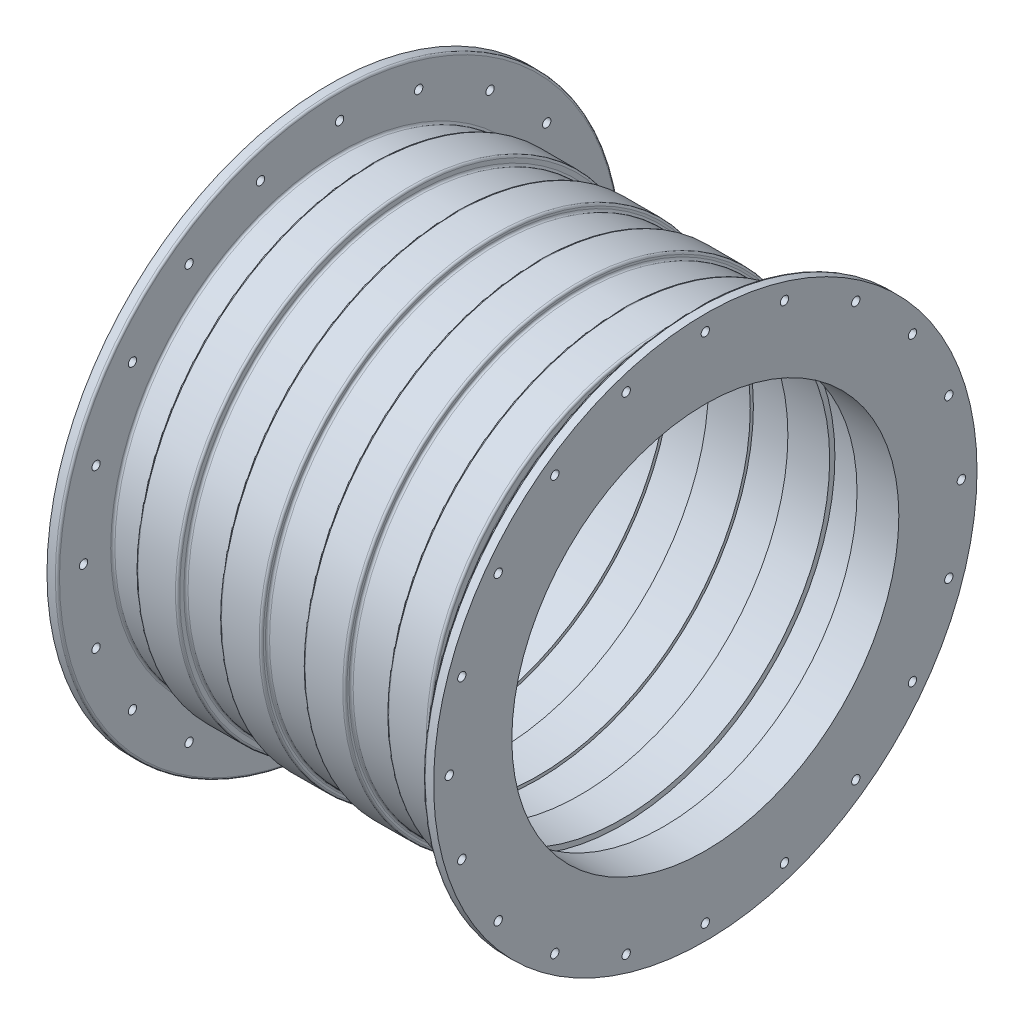
from build123d import *

# Parameters (mm, degrees)
SKETCH2_R          = 2
CUT_EXTRUDE1_DEPTH = 263.392835268
CIRPATTERN1_COUNT  = 20
FILLET1_R          = 1


with BuildPart() as part:
    # Sketch1 → Revolve1 (revolve)
    with BuildSketch(Plane.XY, mode=Mode.PRIVATE) as revolve1_sk:
        Polygon((-56.714285714, 101.5), (-56.714285714, 105.5), (-36.714285714, 105.5), (-36.714285714, 102.502047748), (-16.714285714, 102.502047748), (-16.714285714, 104), (3.285714286, 104), (3.285714286, 101.5), (23.285714286, 101.5), (23.285714286, 103), (43.285714286, 103), (43.285714286, 99.5), (63.285714286, 99.5), (63.285714286, 102), (83.285714286, 102), (83.285714286, 92.587237719), (103.285714286, 92.587237719), (103.285714286, 130), (98.285714286, 130), (98.285714286, 107.587237719), (83.285714286, 107.587237719), (83.285714286, 112.5), (63.285714286, 112.5), (63.285714286, 109.5), (43.285714286, 109.5), (43.285714286, 112.5), (23.285714286, 112.5), (23.285714286, 109.5), (3.285714286, 109.5), (3.285714286, 112.5), (-16.714285714, 112.5), (-16.714285714, 108.5), (-36.714285714, 108.5), (-36.714285714, 112.5), (-56.714285714, 112.5), (-56.714285714, 108.5), (-71.714285714, 108.5), (-71.714285714, 135), (-76.714285714, 135), (-76.714285714, 101.5), align=None)
    revolve(revolve1_sk.sketch.rotate(Axis((120.399774702, 0, 0), (-1, 0, 0)), 90), axis=Axis((120.399774702, 0, 0), (-1, 0, 0)))

    # Sketch2 → Cut-Extrude1 (cut, through all)
    with BuildSketch(Plane.ZY.offset(76.714285714)):
        with Locations((0, 122.5)):
            Circle(SKETCH2_R)
    cut_extrude1 = extrude(amount=-CUT_EXTRUDE1_DEPTH, mode=Mode.SUBTRACT)

    # CirPattern1: Cut-Extrude1 ×20 about axis
    cirpattern1_axis = Axis((0, 0, 0), (1, 0, 0))
    for i in range(1, CIRPATTERN1_COUNT):
        add(cut_extrude1.rotate(cirpattern1_axis, i * 360 / CIRPATTERN1_COUNT), mode=Mode.SUBTRACT)

    # Fillet1
    fillet1_edges = [part.edges().sort_by_distance(p)[0] for p in [
        (-36.714285714, 0, 108.5),
        (-16.714285714, 0, 108.5),
        (-16.714285714, 0, 112.5),
        (3.285714286, 0, 112.5),
        (3.285714286, 0, 109.5),
        (23.285714286, 0, 109.5),
        (23.285714286, 0, 112.5),
        (43.285714286, 0, 112.5),
        (43.285714286, 0, 109.5),
        (63.285714286, 0, 109.5),
        (63.285714286, 0, 112.5),
        (83.285714286, 0, 112.5),
        (83.285714286, 0, 107.587237719),
        (98.285714286, 0, 107.587237719),
        (98.285714286, 0, 130),
        (-71.714285714, 0, 135),
        (-71.714285714, 0, 108.5),
        (-56.714285714, 0, 112.5),
        (-36.714285714, 0, 112.5),
    ]]
    fillet(fillet1_edges, radius=FILLET1_R)


solid = part.part
